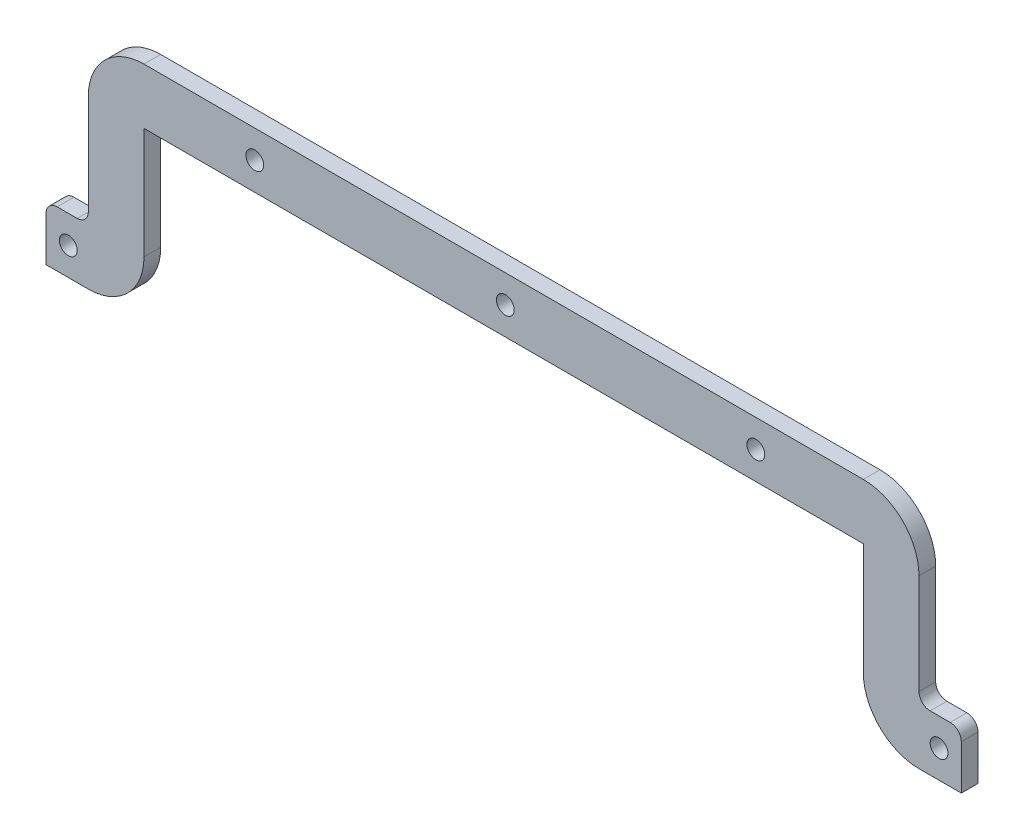
from build123d import *

# Parameters (mm, degrees)
SKETCH2_R           = 1.6
BOSS_EXTRUDE1_DEPTH = 3
CUT_EXTRUDE1_REACH  = 100.01
SKETCH3_R           = 1.6
FILLET1_R           = 10
FILLET2_R           = 2


with BuildPart() as part:
    # Sketch2 → Boss-Extrude1 (new body)
    with BuildSketch(Plane.XY):
        Polygon((-74.424572317, -1.251944012), (-56.824572317, -1.251944012), (-56.824572317, 28.748055988), (72.375427683, 28.748055988), (72.375427683, -1.251944012), (89.975427683, -1.251944012), (89.975427683, 8.748055988), (82.375427683, 8.748055988), (82.375427683, 38.748055988), (-66.824572317, 38.748055988), (-66.824572317, 8.748055988), (-74.424572317, 8.748055988), align=None)
        with Locations((-70.424572317, 3.748055988)):
            Circle(SKETCH2_R, mode=Mode.SUBTRACT)
        with Locations(Location((85.975427683, 3.748055988, 0), (0, 0, 180))):
            Circle(SKETCH2_R, mode=Mode.SUBTRACT)
    extrude(amount=BOSS_EXTRUDE1_DEPTH)

    # Sketch3 → Cut-Extrude1 (cut, up to next)
    with BuildSketch(Plane.XY.offset(3), mode=Mode.PRIVATE) as cut_extrude1_sk1:
        with Locations((-36.924572317, 33.748055988)):
            Circle(SKETCH3_R)
    cut_extrude1_tool1 = extrude(cut_extrude1_sk1.sketch, amount=-CUT_EXTRUDE1_REACH, mode=Mode.PRIVATE) & part.part
    # Sketch3 → Cut-Extrude1 (cut, up to next)
    with BuildSketch(Plane.XY.offset(3), mode=Mode.PRIVATE) as cut_extrude1_sk2:
        with Locations((8.075427683, 33.748055988)):
            Circle(SKETCH3_R)
    cut_extrude1_tool2 = extrude(cut_extrude1_sk2.sketch, amount=-CUT_EXTRUDE1_REACH, mode=Mode.PRIVATE) & part.part
    # Sketch3 → Cut-Extrude1 (cut, up to next)
    with BuildSketch(Plane.XY.offset(3), mode=Mode.PRIVATE) as cut_extrude1_sk3:
        with Locations((53.075427683, 33.748055988)):
            Circle(SKETCH3_R)
    cut_extrude1_tool3 = extrude(cut_extrude1_sk3.sketch, amount=-CUT_EXTRUDE1_REACH, mode=Mode.PRIVATE) & part.part
    add(cut_extrude1_tool1.solids().sort_by_distance((-36.924572, 33.748056, 3))[0], mode=Mode.SUBTRACT)
    add(cut_extrude1_tool2.solids().sort_by_distance((8.075428, 33.748056, 3))[0], mode=Mode.SUBTRACT)
    add(cut_extrude1_tool3.solids().sort_by_distance((53.075428, 33.748056, 3))[0], mode=Mode.SUBTRACT)

    # Fillet1
    fillet1_edges = [part.edges().sort_by_distance(p)[0] for p in [
        (-66.824572317, 38.748055988, 1.5),
        (82.375427683, 38.748055988, 1.5),
        (72.375427683, -1.251944012, 1.5),
        (-56.824572317, -1.251944012, 1.5),
    ]]
    fillet(fillet1_edges, radius=FILLET1_R)

    # Fillet2
    fillet2_edges = [part.edges().sort_by_distance(p)[0] for p in [
        (-74.424572317, 8.748055988, 1.5),
        (-66.824572317, 8.748055988, 1.5),
        (82.375427683, 8.748055988, 1.5),
        (89.975427683, 8.748055988, 1.5),
    ]]
    fillet(fillet2_edges, radius=FILLET2_R)


solid = part.part
